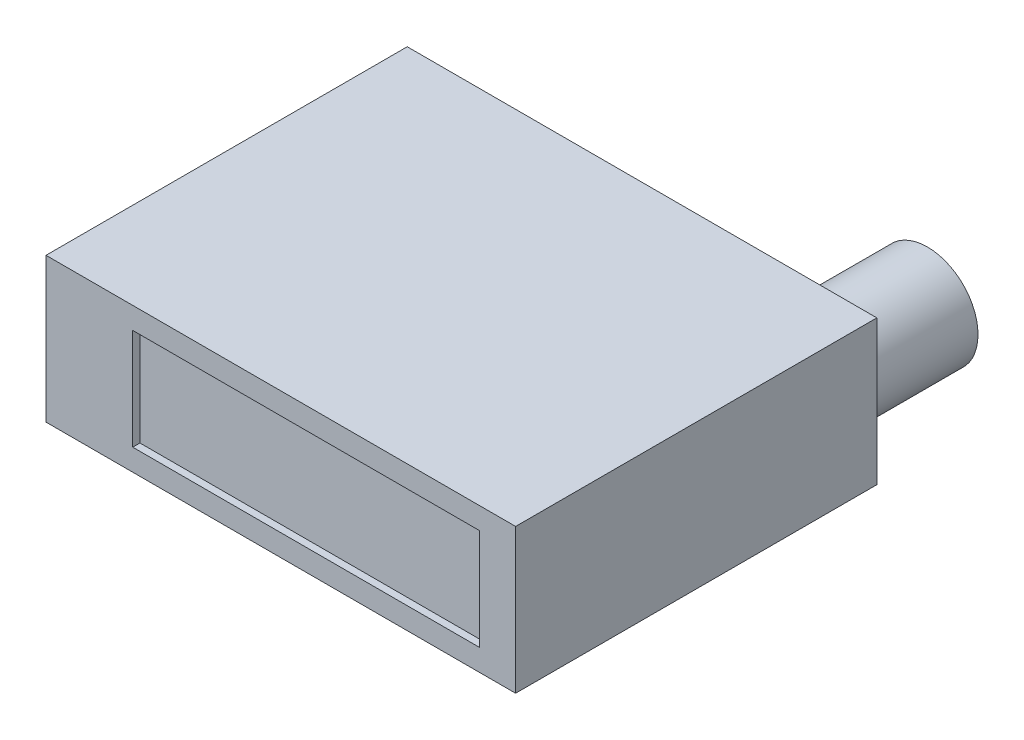
from build123d import *

# Parameters (mm, degrees)
SKETCH2_W           = 65
SKETCH2_H           = 50
BOSS_EXTRUDE1_DEPTH = 20
SKETCH3_R           = 7
BOSS_EXTRUDE2_DEPTH = 15
SKETCH4_W           = 48
SKETCH4_H           = 14
CUT_EXTRUDE1_DEPTH  = 1


with BuildPart() as part:
    # Sketch2 → Boss-Extrude1 (new body)
    with BuildSketch(Plane(origin=(0, 0, 0), x_dir=(1, 0, 0), z_dir=(0, 1, 0))):
        Rectangle(SKETCH2_W, SKETCH2_H)
    extrude(amount=BOSS_EXTRUDE1_DEPTH)

    # Sketch3 → Boss-Extrude2 (add)
    with BuildSketch(Plane(origin=(0, 0, -25), x_dir=(-1, 0, 0), z_dir=(0, 0, -1))):
        with Locations(Location((-24.5, 10, 0), (0, 0, 180))):
            Circle(SKETCH3_R)
    extrude(amount=BOSS_EXTRUDE2_DEPTH)

    # Sketch4 → Cut-Extrude1 (cut)
    with BuildSketch(Plane.XY.offset(25)):
        with Locations((3.5, 10)):
            Rectangle(SKETCH4_W, SKETCH4_H)
    extrude(amount=-CUT_EXTRUDE1_DEPTH, mode=Mode.SUBTRACT)


solid = part.part
